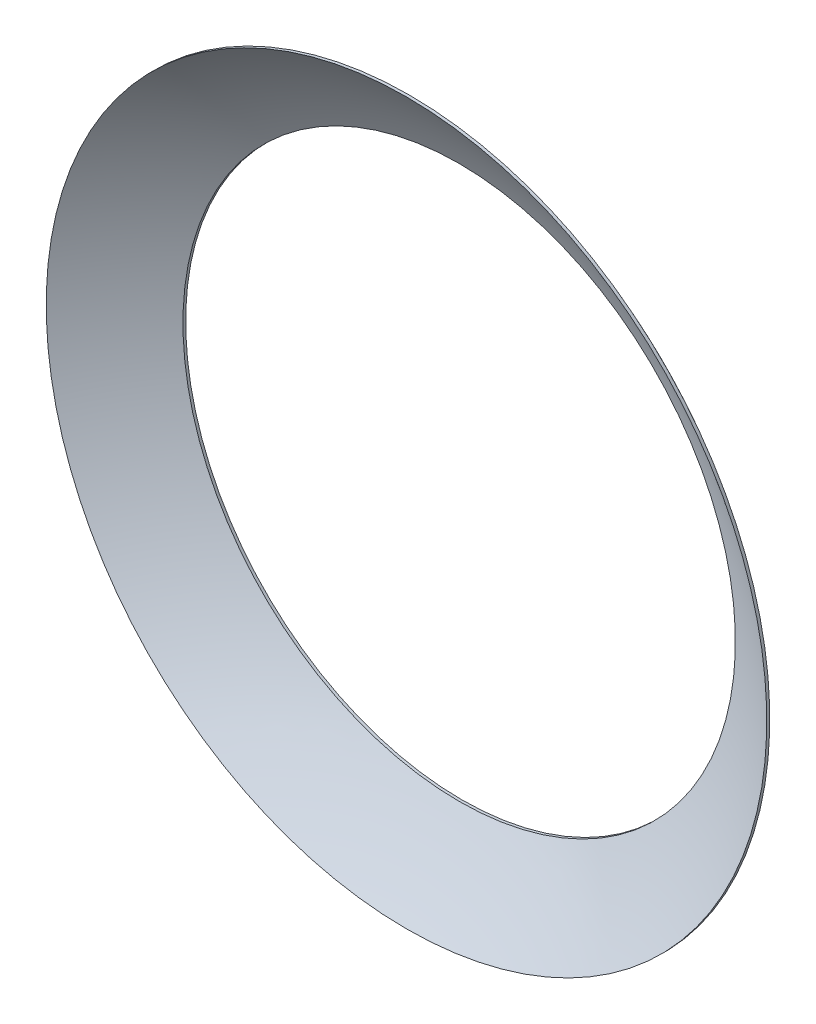
from build123d import *

# Parameters (mm, degrees)
REVOLVE_1_ANGLE      = 180
SHELL_1_T            = 0.5
SKETCH_2_OUTSIDE_W   = 328.82
SKETCH_2_OUTSIDE_H   = 328.82
SKETCH_2_OUTSIDE_R   = 75
SKETCH_2_OUTSIDE_R_2 = 57.5
CUT_EXTRUDE_1_DEPTH  = 323


with BuildPart() as part:
    # 草图1 → 旋转1 (revolve)
    with BuildSketch(Plane.XY):
        with BuildLine():
            Line((0, -125.2), (0, 125.2))
            ThreePointArc((0, 125.2), (-125.2, 0), (0, -125.2))
        make_face()
    revolve(axis=Axis((0, 175.755690027, 0), (0, -1, 0)), revolution_arc=REVOLVE_1_ANGLE)

    # 抽壳1
    shell_1_openings = [part.faces().sort_by_distance(p)[0] for p in [
        (0, 0, 0),
    ]]
    offset(amount=SHELL_1_T, openings=shell_1_openings)

    # 草图2 outside → 切除-拉伸1 (cut)
    # profile 1 of 2: a face of its own
    with BuildSketch(Plane(origin=(0, 0, 0), x_dir=(1, 0, 0), z_dir=(0, 0, -1))):
        Rectangle(SKETCH_2_OUTSIDE_W, SKETCH_2_OUTSIDE_H)
        with Locations(Location((0, 0, 0), (0, 0, 90))):
            Circle(SKETCH_2_OUTSIDE_R, mode=Mode.SUBTRACT)
    # profile 2 of 2: a face of its own
    with BuildSketch(Plane(origin=(0, 0, 0), x_dir=(1, 0, 0), z_dir=(0, 0, -1))):
        with Locations(Location((0, 0, 0), (0, 0, 90))):
            Circle(SKETCH_2_OUTSIDE_R_2)
    extrude(amount=CUT_EXTRUDE_1_DEPTH, mode=Mode.SUBTRACT)


solid = part.part
